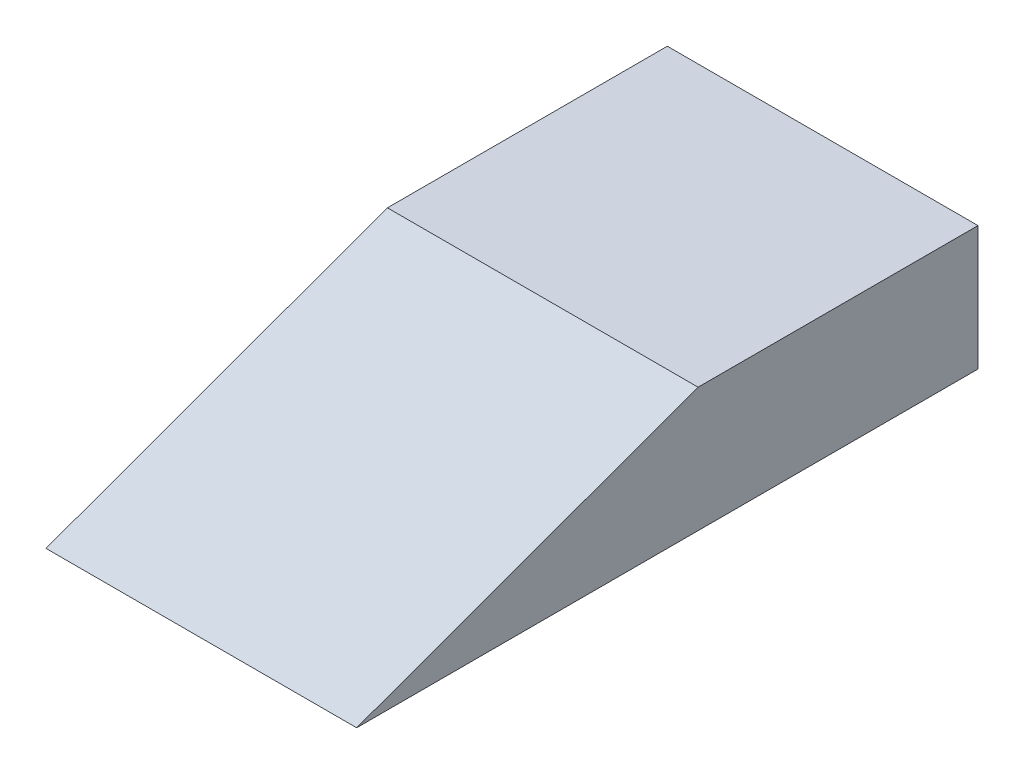
from build123d import *

# Parameters (mm, degrees)
BOSS_EXTRUDE1_DEPTH = 500


with BuildPart() as part:
    # Sketch1 → Boss-Extrude1 (new body)
    with BuildSketch(Plane(origin=(0, 0, 0), x_dir=(0, 0, -1), z_dir=(1, 0, 0))):
        Polygon((0, 0), (549.495483891, 200), (1000, 200), (1000, 0), align=None)
    extrude(amount=BOSS_EXTRUDE1_DEPTH)


solid = part.part
